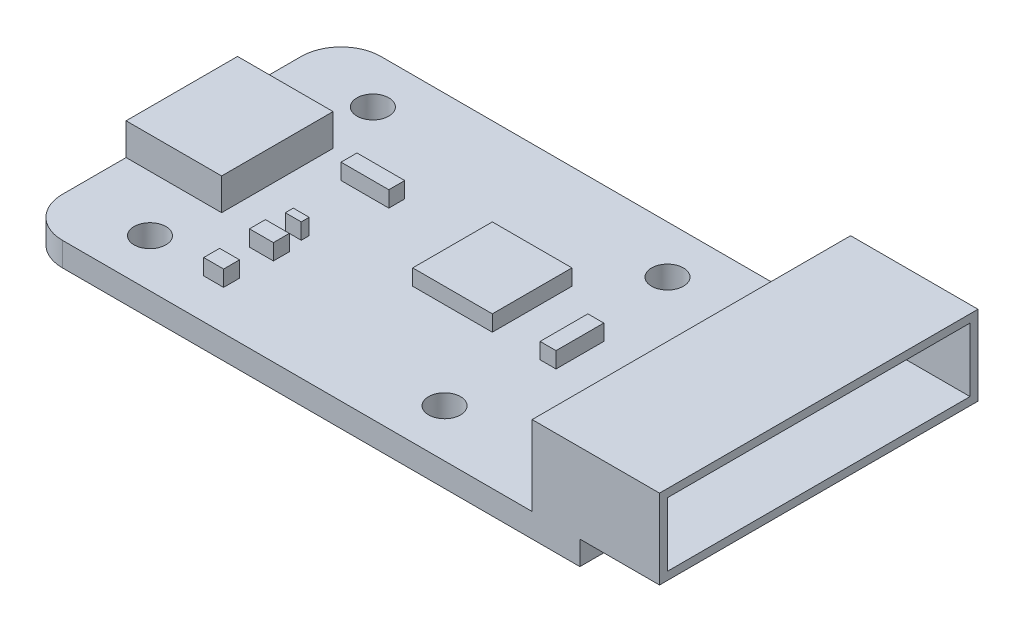
from build123d import *

# Parameters (mm, degrees)
SKETCH1_W           = 35
SKETCH1_H           = 20
BOSS_EXTRUDE1_DEPTH = 1.5
FILLET1_R           = 2.5
SKETCH2_R           = 1
CUT_EXTRUDE1_DEPTH  = 1.5
SKETCH3_W           = 6
SKETCH3_H           = 7
BOSS_EXTRUDE2_DEPTH = 2
SKETCH4_W           = 6.5
SKETCH4_H           = 1.5
CUT_EXTRUDE2_DEPTH  = 5.5
SKETCH5_W           = 8
SKETCH5_H           = 20
BOSS_EXTRUDE3_DEPTH = 5
SKETCH6_W           = 19
SKETCH6_H           = 4
CUT_EXTRUDE3_DEPTH  = 7
SKETCH7_W           = 5
SKETCH7_H           = 5
BOSS_EXTRUDE4_DEPTH = 1
SKETCH8_W           = 1.25
SKETCH8_H           = 1
SKETCH8_W_2         = 1.5
SKETCH8_W_3         = 1
SKETCH8_H_2         = 0.5
SKETCH8_W_4         = 3
SKETCH8_H_3         = 3
BOSS_EXTRUDE5_DEPTH = 1


with BuildPart() as part:
    # Sketch1 → Boss-Extrude1 (new body)
    with BuildSketch(Plane(origin=(0, 0, 0), x_dir=(1, 0, 0), z_dir=(0, 1, 0))):
        Rectangle(SKETCH1_W, SKETCH1_H)
    extrude(amount=BOSS_EXTRUDE1_DEPTH)

    # Fillet1
    fillet1_edges = [part.edges().sort_by_distance(p)[0] for p in [
        (-17.5, 0.75, 10),
        (-17.5, 0.75, -10),
    ]]
    fillet(fillet1_edges, radius=FILLET1_R)

    # Sketch2 → Cut-Extrude1 (cut)
    with BuildSketch(Plane(origin=(0, 1.5, 0), x_dir=(1, 0, 0), z_dir=(0, 1, 0))):
        with Locations(Location((-12.5, 7, 0), (0, 0, 270))):
            Circle(SKETCH2_R)
        with Locations(Location((6, 7, 0), (0, 0, 270))):
            Circle(SKETCH2_R)
        with Locations(Location((6, -7, 0), (0, 0, 90))):
            Circle(SKETCH2_R)
        with Locations(Location((-12.5, -7, 0), (0, 0, 90))):
            Circle(SKETCH2_R)
    extrude(amount=-CUT_EXTRUDE1_DEPTH, mode=Mode.SUBTRACT)

    # Sketch3 → Boss-Extrude2 (add)
    with BuildSketch(Plane(origin=(0, 1.5, 0), x_dir=(1, 0, 0), z_dir=(0, 1, 0))):
        with Locations((-14.5, 0)):
            Rectangle(SKETCH3_W, SKETCH3_H)
    extrude(amount=BOSS_EXTRUDE2_DEPTH)

    # Sketch4 → Cut-Extrude2 (cut)
    with BuildSketch(Plane.ZY.offset(17.5)):
        with Locations((0, 2.5)):
            Rectangle(SKETCH4_W, SKETCH4_H)
    extrude(amount=-CUT_EXTRUDE2_DEPTH, mode=Mode.SUBTRACT)

    # Sketch5 → Boss-Extrude3 (add)
    with BuildSketch(Plane(origin=(0, 1.5, 0), x_dir=(1, 0, 0), z_dir=(0, 1, 0))):
        with Locations((18.5, 0)):
            Rectangle(SKETCH5_W, SKETCH5_H)
    extrude(amount=BOSS_EXTRUDE3_DEPTH)

    # Sketch6 → Cut-Extrude3 (cut)
    with BuildSketch(Plane(origin=(22.5, 0, 0), x_dir=(0, 0, -1), z_dir=(1, 0, 0))):
        with Locations((0, 4)):
            Rectangle(SKETCH6_W, SKETCH6_H)
    extrude(amount=-CUT_EXTRUDE3_DEPTH, mode=Mode.SUBTRACT)

    # Sketch7 → Boss-Extrude4 (add)
    with BuildSketch(Plane(origin=(0, 1.5, 0), x_dir=(1, 0, 0), z_dir=(0, 1, 0))):
        with Locations((1, 1)):
            Rectangle(SKETCH7_W, SKETCH7_H)
    extrude(amount=BOSS_EXTRUDE4_DEPTH)

    # Sketch8 → Boss-Extrude5 (add)
    with BuildSketch(Plane(origin=(0, 1.5, 0), x_dir=(1, 0, 0), z_dir=(0, 1, 0))):
        with Locations((-8, -7)):
            Rectangle(SKETCH8_W, SKETCH8_H)
        with Locations((-8, -4)):
            Rectangle(SKETCH8_W_2, SKETCH8_H)
        with Locations((-8, -2.25)):
            Rectangle(SKETCH8_W_3, SKETCH8_H_2)
        with Locations((-8, 2.5)):
            Rectangle(SKETCH8_W_4, SKETCH8_H)
        with Locations((7, 0)):
            Rectangle(SKETCH8_W_3, SKETCH8_H_3)
    extrude(amount=BOSS_EXTRUDE5_DEPTH)


solid = part.part
